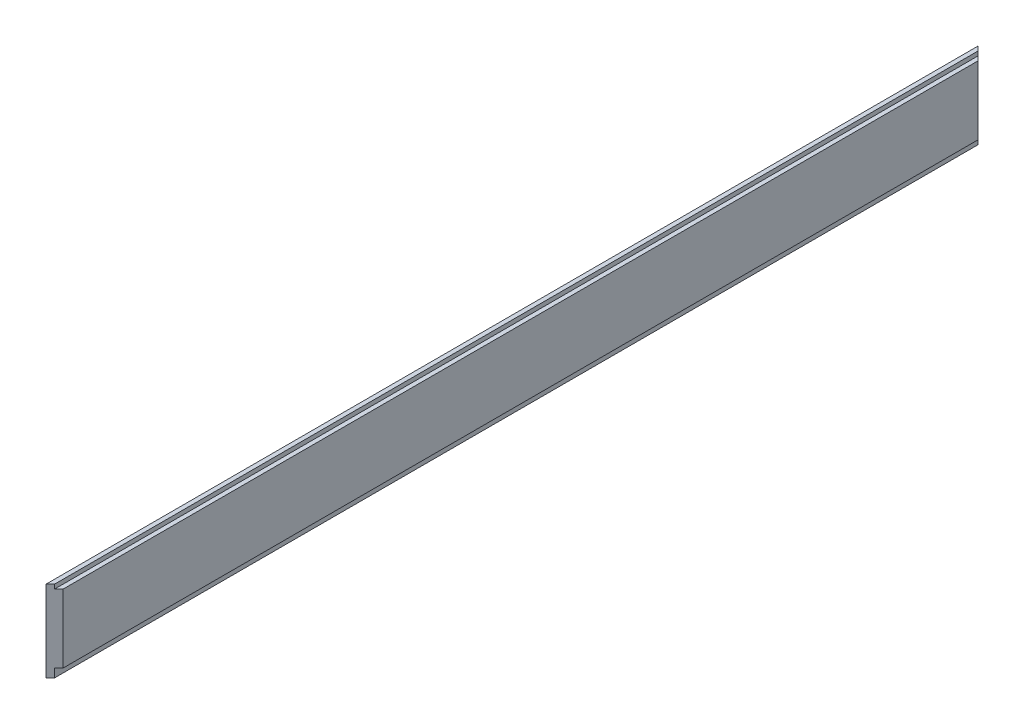
from build123d import *

# Parameters (mm, degrees)
BOSS_EXTRUDE1_DEPTH = 692.15
CUT_EXTRUDE1_DEPTH  = 695.802886166


with BuildPart() as part:
    # Sketch1 → Boss-Extrude1 (new body)
    with BuildSketch(Plane.XY):
        Polygon((0, 0), (0, 60.325), (3.175, 60.325), (3.175, 57.15), (6.35, 57.15), (6.35, 6.35), (3.175, 6.35), (3.175, 0), align=None)
    extrude(amount=BOSS_EXTRUDE1_DEPTH)

    # Sketch2 → Cut-Extrude1 (cut, through all)
    with BuildSketch(Plane(origin=(0, 60.325, 0), x_dir=(1, 0, 0), z_dir=(0, 1, 0))):
        Polygon((0, 0), (6.35, -6.35), (6.35, 0), align=None)
    cut_extrude1 = extrude(amount=-CUT_EXTRUDE1_DEPTH, mode=Mode.SUBTRACT)

    # Mirror1: Cut-Extrude1 across plane
    add(cut_extrude1.mirror(Plane.XY.offset(346.075)), mode=Mode.SUBTRACT)


solid = part.part
